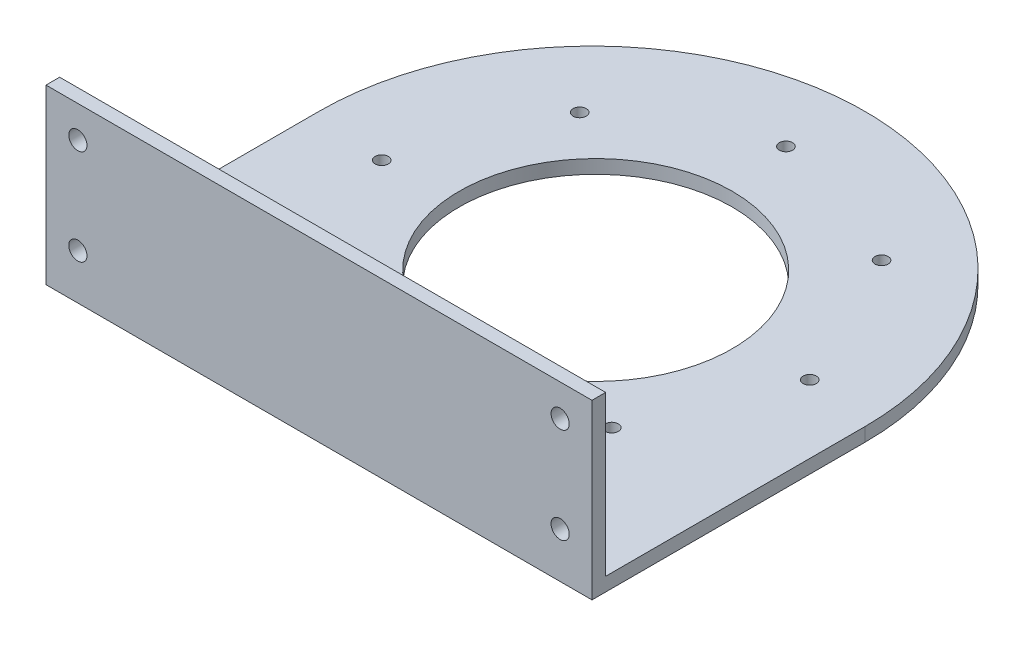
from build123d import *

# Parameters (mm, degrees)
BOSS_EXTRUDE1_DEPTH = 3
SKETCH2_W           = 3
SKETCH2_H           = 35
BOSS_EXTRUDE2_DEPTH = 120
SKETCH3_R           = 2
CUT_EXTRUDE1_DEPTH  = 10


with BuildPart() as part:
    # Sketch1 → Boss-Extrude1 (new body)
    with BuildSketch(Plane(origin=(0, 0, 0), x_dir=(1, 0, 0), z_dir=(0, 1, 0))):
        with BuildLine():
            ThreePointArc((60, 0), (0, 60), (-60, 0))
            Line((-60, 0), (-60, -60))
            Line((-60, -60), (60, -60))
            Line((60, -60), (60, 0))
        make_face()
        with BuildLine():
            ThreePointArc((-28.86964292, -34.498602179), (-30.402233374, -33.136190163), (-29.039821358, -31.603599709))
            ThreePointArc((-29.039821358, -31.603599709), (-27.507230904, -32.966011725), (-28.86964292, -34.498602179))
        make_face(mode=Mode.SUBTRACT)
        with BuildLine():
            ThreePointArc((-43.727439791, -3.851425062), (-45.260030245, -2.489013046), (-43.89761823, -0.956422592))
            ThreePointArc((-43.89761823, -0.956422592), (-42.365027776, -2.318834608), (-43.727439791, -3.851425062))
        make_face(mode=Mode.SUBTRACT)
        with BuildLine():
            ThreePointArc((3.137054327, -42.768377551), (4.669644781, -44.130789567), (3.307232765, -45.663380021))
            ThreePointArc((3.307232765, -45.663380021), (1.774642311, -44.300968005), (3.137054327, -42.768377551))
        make_face(mode=Mode.SUBTRACT)
        with BuildLine():
            ThreePointArc((32.289465784, -26.581793404), (33.822056238, -27.944205419), (32.459644223, -29.476795874))
            ThreePointArc((32.459644223, -29.476795874), (30.927053769, -28.114383858), (32.289465784, -26.581793404))
        make_face(mode=Mode.SUBTRACT)
        with BuildLine():
            ThreePointArc((-31.06789629, 26.996663347), (-32.600486744, 28.359075363), (-31.238074729, 29.891665817))
            ThreePointArc((-31.238074729, 29.891665817), (-29.705484275, 28.529253801), (-31.06789629, 26.996663347))
        make_face(mode=Mode.SUBTRACT)
        with BuildLine():
            ThreePointArc((-2.085663271, 46.078249964), (-0.553072817, 44.715837949), (-1.915484832, 43.183247495))
            ThreePointArc((-1.915484832, 43.183247495), (-3.448075286, 44.54565951), (-2.085663271, 46.078249964))
        make_face(mode=Mode.SUBTRACT)
        with BuildLine():
            ThreePointArc((29.082980246, 9.659105906), (10.062455681, -28.264760528), (-27.861410752, -9.244235963))
            ThreePointArc((-27.861410752, -9.244235963), (-8.840886187, 28.679630471), (29.082980246, 9.659105906))
        make_face(mode=Mode.SUBTRACT)
        with BuildLine():
            ThreePointArc((44.949009286, 4.266295005), (46.48159974, 2.90388299), (45.119187724, 1.371292536))
            ThreePointArc((45.119187724, 1.371292536), (43.58659727, 2.733704551), (44.949009286, 4.266295005))
        make_face(mode=Mode.SUBTRACT)
        with BuildLine():
            ThreePointArc((30.261390853, 32.018469652), (28.728800399, 33.380881668), (30.091212414, 34.913472122))
            ThreePointArc((30.091212414, 34.913472122), (31.623802868, 33.551060107), (30.261390853, 32.018469652))
        make_face(mode=Mode.SUBTRACT)
    extrude(amount=BOSS_EXTRUDE1_DEPTH)

    # Sketch2 → Boss-Extrude2 (add)
    with BuildSketch(Plane.ZY.offset(60)):
        with Locations((58.5, 20.5)):
            Rectangle(SKETCH2_W, SKETCH2_H)
    extrude(amount=-BOSS_EXTRUDE2_DEPTH)

    # Sketch3 → Cut-Extrude1 (cut)
    with BuildSketch(Plane(origin=(0, 0, 57), x_dir=(-1, 0, 0), z_dir=(0, 0, -1))):
        with Locations((-53, 31)):
            Circle(SKETCH3_R)
        with Locations((53, 31)):
            Circle(SKETCH3_R)
        with Locations((53, 10)):
            Circle(SKETCH3_R)
        with Locations((-53, 10)):
            Circle(SKETCH3_R)
    extrude(amount=-CUT_EXTRUDE1_DEPTH, mode=Mode.SUBTRACT)


solid = part.part
